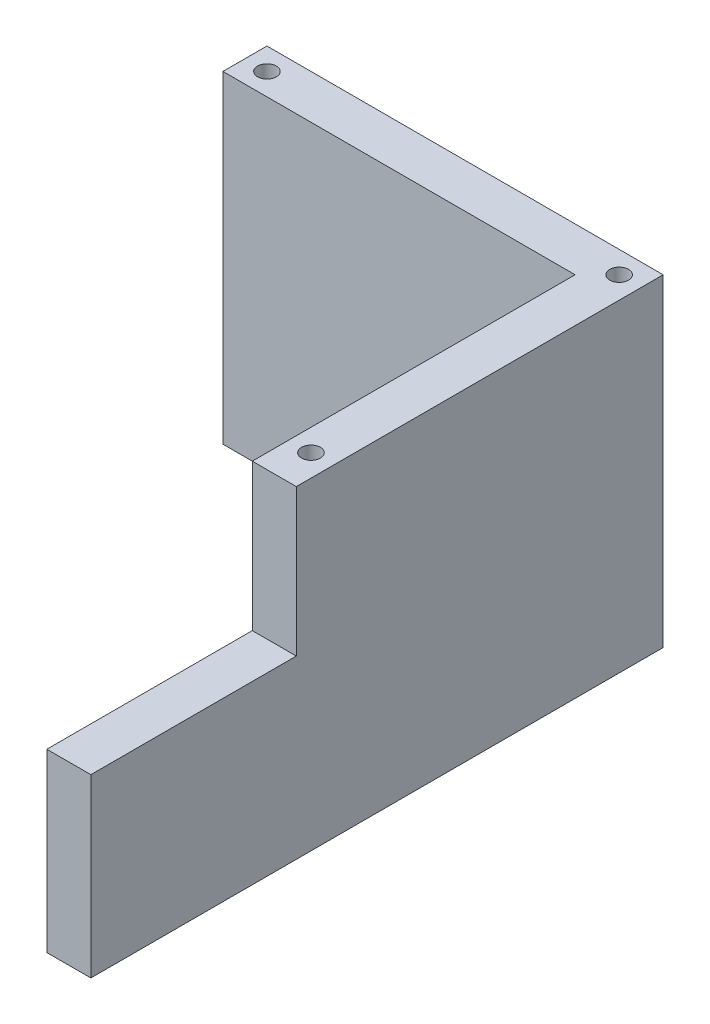
from build123d import *

# Parameters (mm, degrees)
BOSS_EXTRUDE1_DEPTH                            = 69.85
CBORE_FOR_4_SOCKET_HEAD_CAP_SCREW1_D           = 3.2639
CBORE_FOR_4_SOCKET_HEAD_CAP_SCREW1_DEPTH       = 9.525
CBORE_FOR_4_SOCKET_HEAD_CAP_SCREW1_CBORE_D     = 3.96875
CBORE_FOR_4_SOCKET_HEAD_CAP_SCREW1_CBORE_DEPTH = 4.7625
CBORE_FOR_4_SOCKET_HEAD_CAP_SCREW1_TIP         = 0.980574487
SKETCH4_R                                      = 2.032
CUT_EXTRUDE1_DEPTH                             = 4.7625
SKETCH7_R                                      = 1.63195
CUT_EXTRUDE4_DEPTH                             = 3.175
CUT_EXTRUDE3_REACH                             = 168.013
SKETCH6_W                                      = 44.45
SKETCH6_H                                      = 31.75


with BuildPart() as part:
    # Sketch1 → Boss-Extrude1 (new body)
    with BuildSketch(Plane(origin=(0, 0, 0), x_dir=(1, 0, 0), z_dir=(0, 1, 0))):
        Polygon((0, -123.825), (0, 0), (-85.725, 0), (-85.725, -9.525), (-9.525, -9.525), (-9.525, -123.825), align=None)
    extrude(amount=BOSS_EXTRUDE1_DEPTH)

    # CBORE for #4 Socket Head Cap Screw1
    with Locations(Plane(origin=(0, 0, 0), x_dir=(-1, 0, 0), z_dir=(0, -1, 0))):
        with Locations((4.7625, -4.7625), (4.7625, -74.6125), (4.7625, -109.5375), (4.7625, -39.6875), (74.6125, -4.7625), (39.6875, -4.7625)):
            CounterBoreHole(CBORE_FOR_4_SOCKET_HEAD_CAP_SCREW1_D / 2, CBORE_FOR_4_SOCKET_HEAD_CAP_SCREW1_CBORE_D / 2, CBORE_FOR_4_SOCKET_HEAD_CAP_SCREW1_CBORE_DEPTH, depth=CBORE_FOR_4_SOCKET_HEAD_CAP_SCREW1_DEPTH)
            with Locations((0, 0, -(CBORE_FOR_4_SOCKET_HEAD_CAP_SCREW1_DEPTH + CBORE_FOR_4_SOCKET_HEAD_CAP_SCREW1_TIP / 2))):  # 118° drill point
                Cone(0, CBORE_FOR_4_SOCKET_HEAD_CAP_SCREW1_D / 2, CBORE_FOR_4_SOCKET_HEAD_CAP_SCREW1_TIP, mode=Mode.SUBTRACT)

    # Sketch4 → Cut-Extrude1 (cut)
    with BuildSketch(Plane(origin=(0, 69.85, 0), x_dir=(1, 0, 0), z_dir=(0, 1, 0))):
        with Locations(Location((-4.7625, -4.7625, 0), (0, 0, 270))):
            Circle(SKETCH4_R)
        with Locations(Location((-4.7625, -71.4375, 0), (0, 0, 270))):
            Circle(SKETCH4_R)
        with Locations(Location((-80.9625, -4.7625, 0), (0, 0, 270))):
            Circle(SKETCH4_R)
    extrude(amount=-CUT_EXTRUDE1_DEPTH, mode=Mode.SUBTRACT)

    # Sketch7 → Cut-Extrude4 (cut)
    with BuildSketch(Plane(origin=(0, 65.0875, 0), x_dir=(1, 0, 0), z_dir=(0, 1, 0))):
        with Locations(Location((-80.9625, -4.7625, 0), (0, 0, 270))):
            Circle(SKETCH7_R)
        with Locations(Location((-4.7625, -4.7625, 0), (0, 0, 90))):
            Circle(SKETCH7_R)
        with Locations(Location((-4.7625, -71.4375, 0), (0, 0, 270))):
            Circle(SKETCH7_R)
    extrude(amount=-CUT_EXTRUDE4_DEPTH, mode=Mode.SUBTRACT)

    # Sketch6 → Cut-Extrude3 (cut, up to next)
    with BuildSketch(Plane(origin=(0, 0, 0), x_dir=(0, 0, -1), z_dir=(1, 0, 0)), mode=Mode.PRIVATE) as cut_extrude3_sk1:
        with Locations((-101.6, 53.975)):
            Rectangle(SKETCH6_W, SKETCH6_H)
    cut_extrude3_tool1 = extrude(cut_extrude3_sk1.sketch, amount=-CUT_EXTRUDE3_REACH, mode=Mode.PRIVATE) & part.part
    add(cut_extrude3_tool1.solids().sort_by_distance((0, 53.975, 101.6))[0], mode=Mode.SUBTRACT)


solid = part.part
